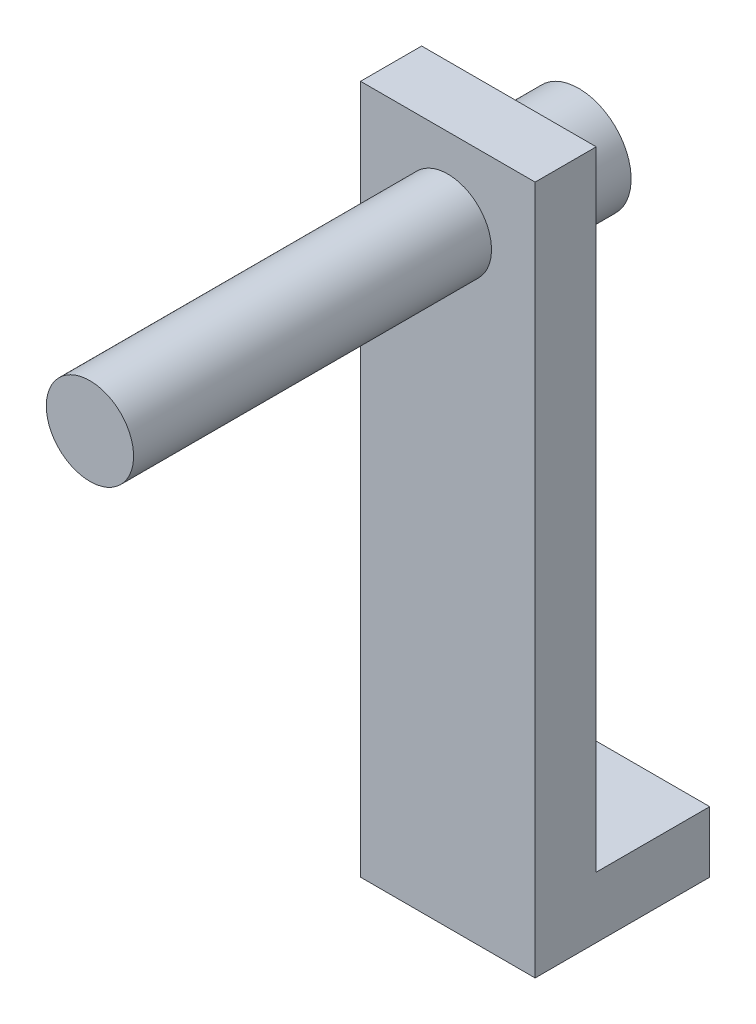
from build123d import *

# Parameters (mm, degrees)
SKETCH_2_W      = 20
SKETCH_2_H      = 20
EXTRUDE_2_DEPTH = 7
SKETCH_4_W      = 20
SKETCH_4_H      = 7
EXTRUDE_3_DEPTH = 78.96
SKETCH_5_R      = 5
EXTRUDE_4_DEPTH = 48
SKETCH_10_R     = 5.997428606
EXTRUDE_5_DEPTH = 8


with BuildPart() as part:
    # Эскиз2 → Бобышка-Вытянуть2 (new body)
    with BuildSketch(Plane(origin=(0, 0, 0), x_dir=(1, 0, 0), z_dir=(0, 1, 0))):
        Rectangle(SKETCH_2_W, SKETCH_2_H)
    extrude(amount=EXTRUDE_2_DEPTH)

    # Эскиз4 → Бобышка-Вытянуть3 (add)
    with BuildSketch(Plane(origin=(0, 0, 0), x_dir=(-1, 0, 0), z_dir=(0, -1, 0))):
        with Locations((0, -6.5)):
            Rectangle(SKETCH_4_W, SKETCH_4_H)
    extrude(amount=-EXTRUDE_3_DEPTH)

    # Эскиз5 → Бобышка-Вытянуть4 (add)
    with BuildSketch(Plane(origin=(0, 0, 3), x_dir=(-1, 0, 0), z_dir=(0, 0, -1))):
        with Locations((0, 69.76)):
            Circle(SKETCH_5_R)
    extrude(amount=-EXTRUDE_4_DEPTH)

    # Эскиз10 → Бобышка-Вытянуть5 (add)
    with BuildSketch(Plane(origin=(0, 0, 3), x_dir=(-1, 0, 0), z_dir=(0, 0, -1))):
        with Locations((0, 69.76)):
            Circle(SKETCH_10_R)
    extrude(amount=EXTRUDE_5_DEPTH)


solid = part.part
